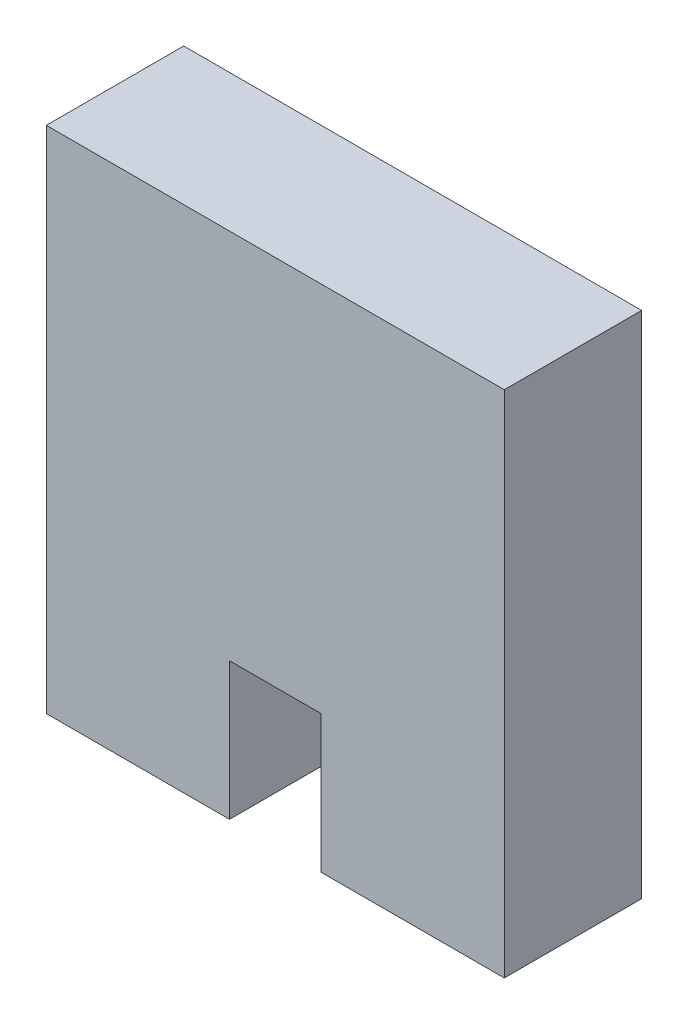
from build123d import *

# Parameters (mm, degrees)
BOSS_EXTRU_1_DEPTH = 6


with BuildPart() as part:
    # Esquisse1 → Boss.-Extru.1 (new body)
    with BuildSketch(Plane.XY):
        Polygon((0, 0), (0, 22.25), (-20, 22.25), (-20, 0), (-12, 0), (-12, 6), (-8, 6), (-8, 0), align=None)
    extrude(amount=BOSS_EXTRU_1_DEPTH)


solid = part.part
